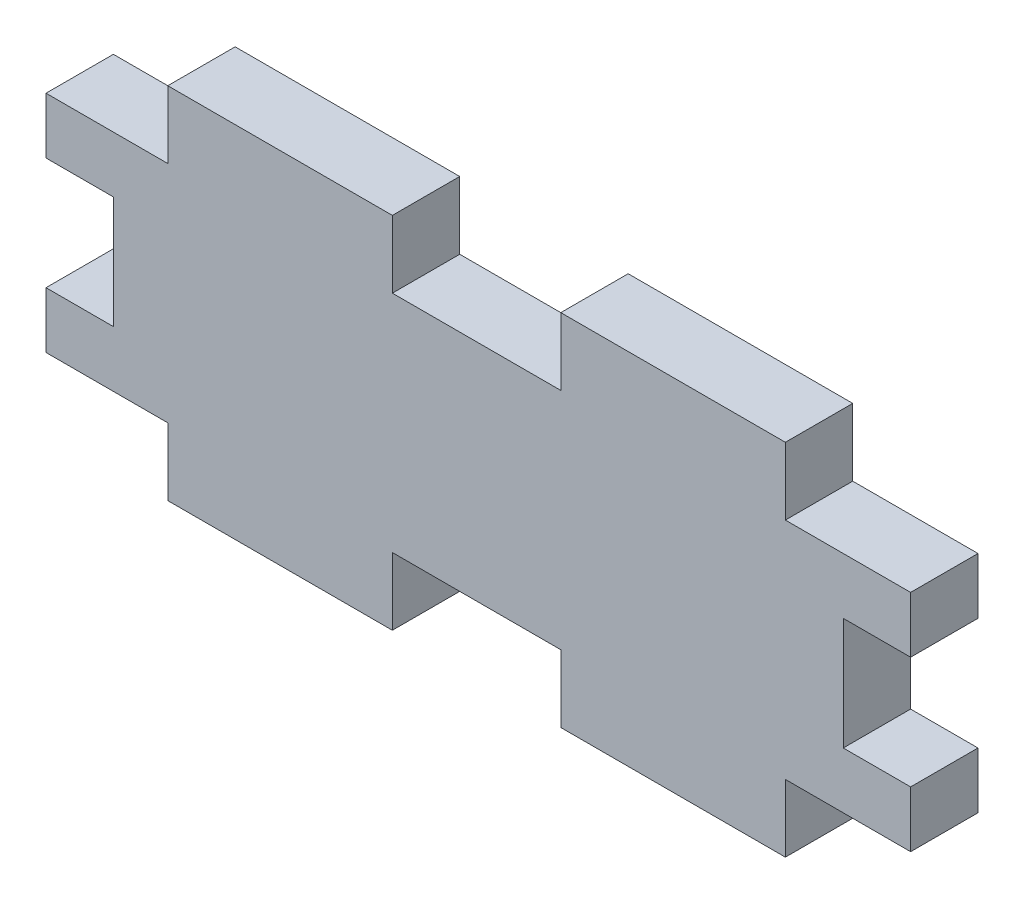
from build123d import *

# Parameters (mm, degrees)
SKETCH1_W           = 10
SKETCH1_H           = 3
BOSS_EXTRUDE1_DEPTH = 3
SKETCH2_W           = 3
SKETCH2_H           = 5
CUT_EXTRUDE1_DEPTH  = 3


with BuildPart() as part:
    # Sketch1 → Boss-Extrude1 (new body)
    with BuildSketch(Plane.XY):
        Polygon((-3.827421787, 35.839698152), (-13.827421787, 35.839698152), (-16.25, 35.839698152), (-19.25, 35.839698152), (-19.25, 25.839698152), (-13.827421787, 25.839698152), (-3.827421787, 25.839698152), (3.672578213, 25.839698152), (13.672578213, 25.839698152), (19.25, 25.839698152), (19.25, 35.839698152), (16.25, 35.839698152), (13.672578213, 35.839698152), (3.672578213, 35.839698152), align=None)
        with Locations((-8.827421787, 37.339698152)):
            Rectangle(SKETCH1_W, SKETCH1_H)
        with Locations((8.672578213, 37.339698152)):
            Rectangle(SKETCH1_W, SKETCH1_H)
        with Locations((-8.827421787, 24.339698152)):
            Rectangle(SKETCH1_W, SKETCH1_H)
        with Locations((8.672578213, 24.339698152)):
            Rectangle(SKETCH1_W, SKETCH1_H)
    extrude(amount=BOSS_EXTRUDE1_DEPTH)

    # Sketch2 → Cut-Extrude1 (cut)
    with BuildSketch(Plane.XY.offset(3)):
        with Locations((-17.75, 30.839698152)):
            Rectangle(SKETCH2_W, SKETCH2_H)
        with Locations((17.75, 30.839698152)):
            Rectangle(SKETCH2_W, SKETCH2_H)
    extrude(amount=-CUT_EXTRUDE1_DEPTH, mode=Mode.SUBTRACT)


solid = part.part
